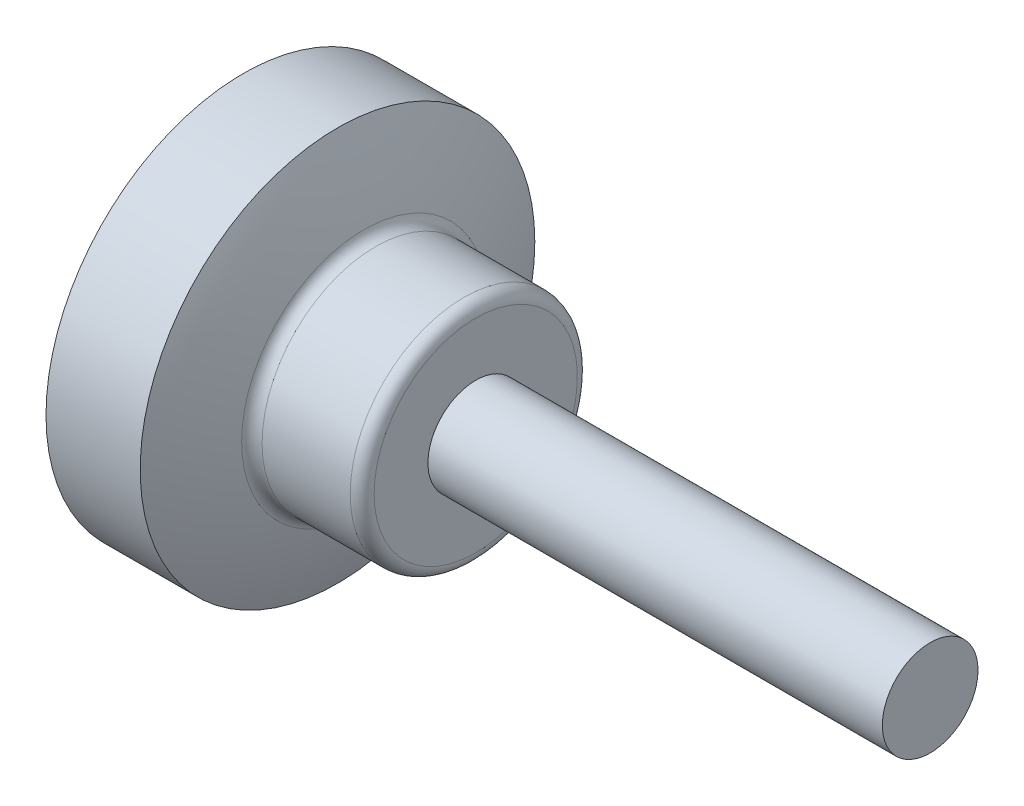
from build123d import *

# Parameters (mm, degrees)
SKETCH2_R           = 4
BOSS_EXTRUDE1_DEPTH = 38


with BuildPart() as part:
    # Sketch1 → Revolve1 (revolve)
    with BuildSketch(Plane(origin=(0, 0, 0), x_dir=(1, 0, 0), z_dir=(0, 1, 0))):
        with BuildLine():
            Line((3.561695978, 16.5), (11.438304022, 16.5))
            ThreePointArc((11.438304022, 16.5), (12.682226863, 13.418262877), (13.666037589, 10.243902439))
            ThreePointArc((13.666037589, 10.243902439), (14.022810492, 9.707504713), (14.632688529, 9.5))
            Line((14.632688529, 9.5), (22, 9.5))
            ThreePointArc((22, 9.5), (22.707106781, 9.207106781), (23, 8.5))
            Line((23, 8.5), (23, 0))
            Line((23, 0), (0, 0))
            ThreePointArc((0, 0), (0.900561635, 8.440018931), (3.561695978, 16.5))
        make_face()
    revolve(axis=Axis((0, 0, 0), (1, 0, 0)))


with BuildPart() as body_2:
    # Sketch2 → Boss-Extrude1 (new body)
    with BuildSketch(Plane(origin=(23, 0, 0), x_dir=(0, 0, -1), z_dir=(1, 0, 0))):
        Circle(SKETCH2_R)
    extrude(amount=BOSS_EXTRUDE1_DEPTH)


solid = Compound([part.part, body_2.part])
